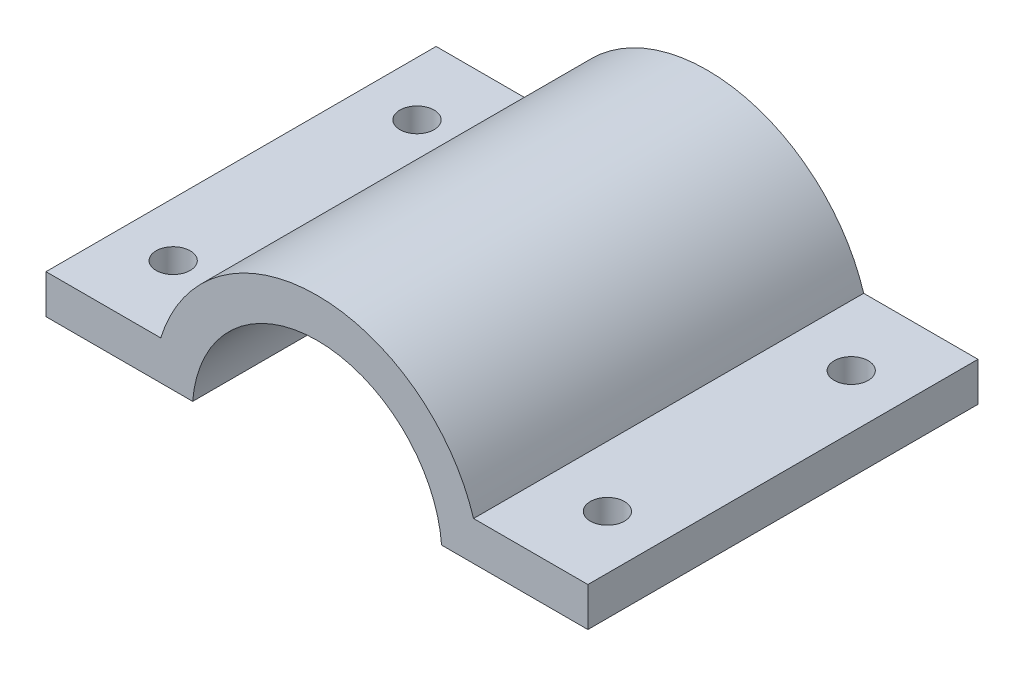
from build123d import *

# Parameters (mm, degrees)
BOSS_EXTRUDE1_DEPTH = 40
CUT_EXTRUDE1_REACH  = 52.121
SKETCH2_R           = 1.75


with BuildPart() as part:
    # Sketch1 → Boss-Extrude1 (new body)
    with BuildSketch(Plane(origin=(0, 0, 0), x_dir=(0, 1, 0), z_dir=(0, 0, 1))):
        with BuildLine():
            Line((1, 12.760877713), (1, 27.8))
            Line((1, 27.8), (5, 27.8))
            Line((5, 27.8), (5, 16.038703189))
            ThreePointArc((5, 16.038703189), (16.8, 0), (5, -16.038703189))
            Line((5, -16.038703189), (5, -27.760877713))
            Line((5, -27.760877713), (1, -27.760877713))
            Line((1, -27.760877713), (1, -12.760877713))
            ThreePointArc((1, -12.760877713), (12.8, 0), (1, 12.760877713))
        make_face()
    extrude(amount=BOSS_EXTRUDE1_DEPTH)

    # Sketch2 → Cut-Extrude1 (cut, up to next)
    with BuildSketch(Plane(origin=(0, 5, 0), x_dir=(-1, 0, 0), z_dir=(0, 1, 0)), mode=Mode.PRIVATE) as cut_extrude1_sk1:
        with Locations((-22.260877713, 32.5)):
            Circle(SKETCH2_R)
    cut_extrude1_tool1 = extrude(cut_extrude1_sk1.sketch, amount=-CUT_EXTRUDE1_REACH, mode=Mode.PRIVATE) & part.part
    # Sketch2 → Cut-Extrude1 (cut, up to next)
    with BuildSketch(Plane(origin=(0, 5, 0), x_dir=(-1, 0, 0), z_dir=(0, 1, 0)), mode=Mode.PRIVATE) as cut_extrude1_sk2:
        with Locations((-22.260877713, 7.5)):
            Circle(SKETCH2_R)
    cut_extrude1_tool2 = extrude(cut_extrude1_sk2.sketch, amount=-CUT_EXTRUDE1_REACH, mode=Mode.PRIVATE) & part.part
    # Sketch2 → Cut-Extrude1 (cut, up to next)
    with BuildSketch(Plane(origin=(0, 5, 0), x_dir=(-1, 0, 0), z_dir=(0, 1, 0)), mode=Mode.PRIVATE) as cut_extrude1_sk3:
        with Locations(Location((22.260877713, 7.5, 0), (0, 0, 90))):
            Circle(SKETCH2_R)
    cut_extrude1_tool3 = extrude(cut_extrude1_sk3.sketch, amount=-CUT_EXTRUDE1_REACH, mode=Mode.PRIVATE) & part.part
    # Sketch2 → Cut-Extrude1 (cut, up to next)
    with BuildSketch(Plane(origin=(0, 5, 0), x_dir=(-1, 0, 0), z_dir=(0, 1, 0)), mode=Mode.PRIVATE) as cut_extrude1_sk4:
        with Locations(Location((22.260877713, 32.5, 0), (0, 0, 90))):
            Circle(SKETCH2_R)
    cut_extrude1_tool4 = extrude(cut_extrude1_sk4.sketch, amount=-CUT_EXTRUDE1_REACH, mode=Mode.PRIVATE) & part.part
    add(cut_extrude1_tool1.solids().sort_by_distance((22.260878, 5, 32.5))[0], mode=Mode.SUBTRACT)
    add(cut_extrude1_tool2.solids().sort_by_distance((22.260878, 5, 7.5))[0], mode=Mode.SUBTRACT)
    add(cut_extrude1_tool3.solids().sort_by_distance((-22.260878, 5, 7.5))[0], mode=Mode.SUBTRACT)
    add(cut_extrude1_tool4.solids().sort_by_distance((-22.260878, 5, 32.5))[0], mode=Mode.SUBTRACT)


solid = part.part
